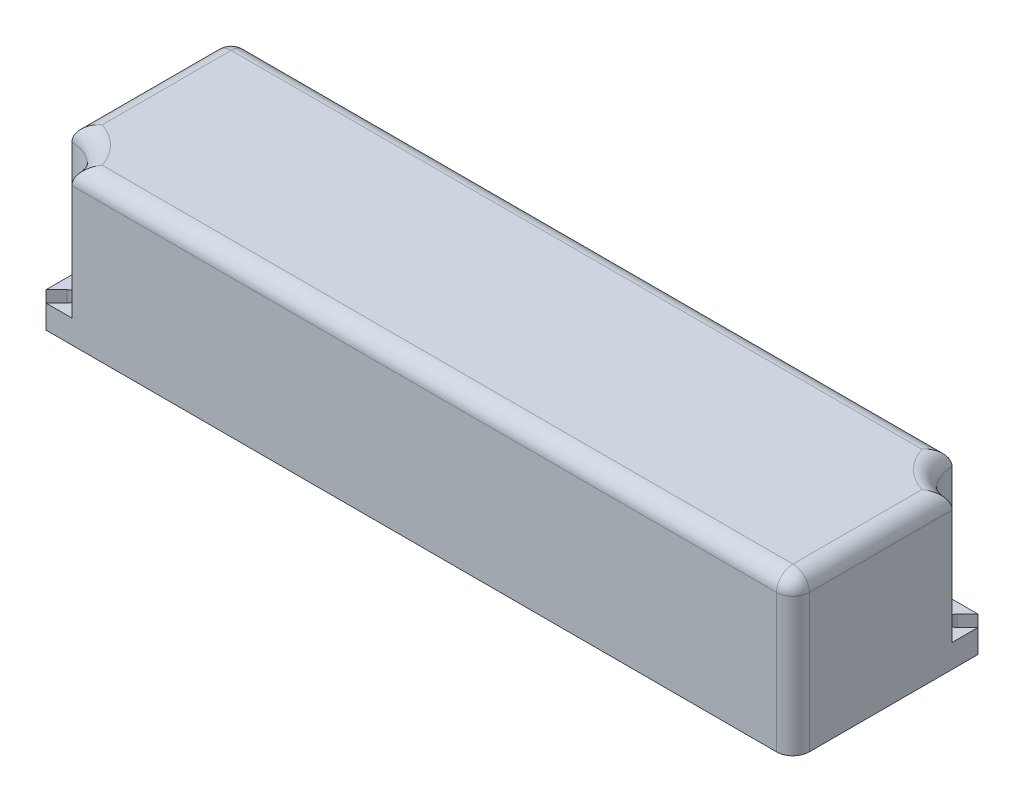
from build123d import *

# Parameters (mm, degrees)
SKIZZE1_W                       = 162
SKIZZE1_H                       = 42
AUFSATZ_LINEAR_AUSTRAGEN1_DEPTH = 33
SKIZZE2_R                       = 8
SCHNITT_LINEAR_AUSTRAGEN1_DEPTH = 28
VERRUNDUNG1_R                   = 3.5
SCHNITT_LINEAR_AUSTRAGEN2_DEPTH = 89.238313821


with BuildPart() as part:
    # Skizze1 → Aufsatz-Linear austragen1 (new body)
    with BuildSketch(Plane(origin=(0, 0, 0), x_dir=(1, 0, 0), z_dir=(0, 1, 0))):
        Rectangle(SKIZZE1_W, SKIZZE1_H)
    extrude(amount=AUFSATZ_LINEAR_AUSTRAGEN1_DEPTH)

    # Skizze2 → Schnitt-Linear austragen1 (cut)
    with BuildSketch(Plane(origin=(0, 33, 0), x_dir=(1, 0, 0), z_dir=(0, 1, 0))):
        with Locations((-81, -21)):
            Circle(SKIZZE2_R)
        with Locations((81, 21)):
            Circle(SKIZZE2_R)
    extrude(amount=-SCHNITT_LINEAR_AUSTRAGEN1_DEPTH, mode=Mode.SUBTRACT)

    # Verrundung1
    verrundung1_edges = [part.edges().sort_by_distance(p)[0] for p in [
        (81, 33, 4),
        (4, 33, 21),
        (-75.343145751, 33, 15.343145751),
        (-4, 33, -21),
        (75.343145751, 33, -15.343145751),
        (-81, 33, -4),
        (-81, 16.5, -21),
        (81, 16.5, 21),
    ]]
    fillet(verrundung1_edges, radius=VERRUNDUNG1_R)

    # Skizze3 → Schnitt-Linear austragen2 (cut, through all)
    with BuildSketch(Plane(origin=(0, 5, 0), x_dir=(1, 0, 0), z_dir=(0, 1, 0))):
        with BuildLine():
            Line((76.262563133, 18.737436867), (79.762563133, 22.237436867))
            ThreePointArc((79.762563133, 22.237436867), (82.237436867, 22.237436867), (82.237436867, 19.762563133))
            Line((82.237436867, 19.762563133), (78.737436867, 16.262563133))
            ThreePointArc((78.737436867, 16.262563133), (76.262563133, 16.262563133), (76.262563133, 18.737436867))
        make_face()
        with BuildLine():
            Line((-76.262563133, -18.737436867), (-79.762563133, -22.237436867))
            ThreePointArc((-79.762563133, -22.237436867), (-82.237436867, -22.237436867), (-82.237436867, -19.762563133))
            Line((-82.237436867, -19.762563133), (-78.737436867, -16.262563133))
            ThreePointArc((-78.737436867, -16.262563133), (-76.262563133, -16.262563133), (-76.262563133, -18.737436867))
        make_face()
    extrude(amount=-SCHNITT_LINEAR_AUSTRAGEN2_DEPTH, mode=Mode.SUBTRACT)


solid = part.part
